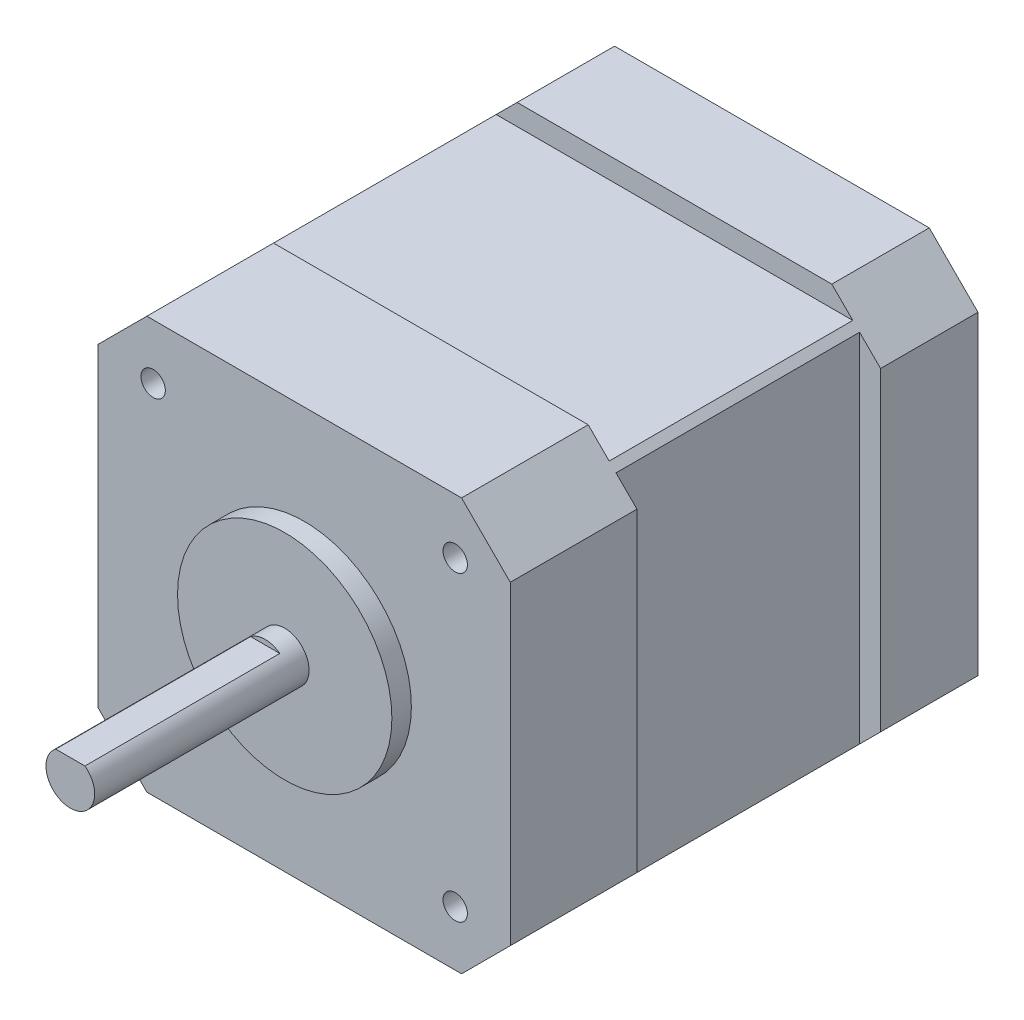
from build123d import *

# Parameters (mm, degrees)
SKETCH_1_W             = 42.3
SKETCH_1_H             = 42.3
EXTRUDE_1_DEPTH        = 48
SKETCH_2_R             = 11
EXTRUDE_2_DEPTH        = 2
SKETCH_3_R             = 2.5
EXTRUDE_3_DEPTH        = 22
CHAMFER_1_SIZE         = 5
HOLE_WIZARD_M3_1_D     = 2.5
HOLE_WIZARD_M3_1_DEPTH = 6
HOLE_WIZARD_M3_1_TIP   = 0.751075774
SKETCH_7_OUTSIDE_W     = 63.022
SKETCH_7_OUTSIDE_H     = 63.022
SKETCH_7_OUTSIDE_W_2   = 38
SKETCH_7_OUTSIDE_H_2   = 38
CUT_EXTRUDE_2_DEPTH    = 25
SKETCH_8_W             = 6.700255884
SKETCH_8_H             = 1.991967966
CUT_EXTRUDE_3_DEPTH    = 20


with BuildPart() as part:
    # 草图1 → 凸台-拉伸1 (new body)
    with BuildSketch(Plane.XY):
        with Locations((21.15, -21.15)):
            Rectangle(SKETCH_1_W, SKETCH_1_H)
    extrude(amount=EXTRUDE_1_DEPTH)

    # 草图2 → 凸台-拉伸2 (add)
    with BuildSketch(Plane.XY.offset(48)):
        with Locations((21.15, -21.15)):
            Circle(SKETCH_2_R)
    extrude(amount=EXTRUDE_2_DEPTH)

    # 草图3 → 凸台-拉伸3 (add)
    with BuildSketch(Plane.XY.offset(50)):
        with Locations((21.15, -21.15)):
            Circle(SKETCH_3_R)
    extrude(amount=EXTRUDE_3_DEPTH)

    # 倒角1
    chamfer_1_edges = [part.edges().sort_by_distance(p)[0] for p in [
        (0, 0, 24),
        (42.3, 0, 24),
        (42.3, -42.3, 24),
        (0, -42.3, 24),
    ]]
    chamfer(chamfer_1_edges, length=CHAMFER_1_SIZE)

    # M3 螺纹孔1
    with Locations(Plane(origin=(5.65, -5.65, 48), x_dir=(1, 0, 0), z_dir=(0, 0, 1))):
        with Locations((0, 0), (0, -31), (31, -31), (31, 0)):
            Hole(HOLE_WIZARD_M3_1_D / 2, depth=HOLE_WIZARD_M3_1_DEPTH)
            with Locations((0, 0, -(HOLE_WIZARD_M3_1_DEPTH + HOLE_WIZARD_M3_1_TIP / 2))):  # 118° drill point
                Cone(0, HOLE_WIZARD_M3_1_D / 2, HOLE_WIZARD_M3_1_TIP, mode=Mode.SUBTRACT)

    # 草图7 outside → 切除-拉伸2 (cut)
    with BuildSketch(Plane(origin=(0, 0, 10), x_dir=(-1, 0, 0), z_dir=(0, 0, -1))):
        with Locations((-21.15, -21.15)):
            Rectangle(SKETCH_7_OUTSIDE_W, SKETCH_7_OUTSIDE_H)
        with Locations((-21.15, -21.15)):
            Rectangle(SKETCH_7_OUTSIDE_W_2, SKETCH_7_OUTSIDE_H_2, mode=Mode.SUBTRACT)
    extrude(amount=-CUT_EXTRUDE_2_DEPTH, mode=Mode.SUBTRACT)

    # 草图8 → 切除-拉伸3 (cut)
    with BuildSketch(Plane.XY.offset(72)):
        with Locations((21.681661742, -18.154016017)):
            Rectangle(SKETCH_8_W, SKETCH_8_H)
    extrude(amount=-CUT_EXTRUDE_3_DEPTH, mode=Mode.SUBTRACT)


solid = part.part
